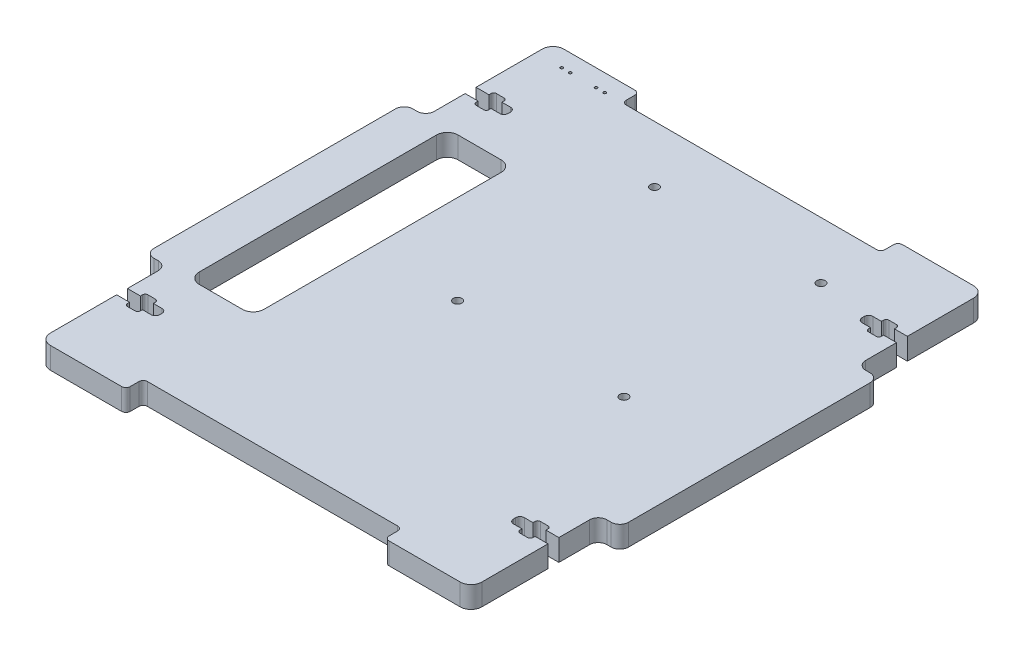
from build123d import *

# Parameters (mm, degrees)
SKETCH1_R           = 0.4
BOSS_EXTRUDE1_DEPTH = 6.35
SKETCH5_R           = 1.25
CUT_EXTRUDE3_DEPTH  = 6.35
SKETCH4_W           = 3.2
SKETCH4_H           = 6.35
CUT_EXTRUDE4_DEPTH  = 11.43
SKETCH2_W           = 3.2
SKETCH2_H           = 6.35
CUT_EXTRUDE5_DEPTH  = 11.43
FILLET1_R           = 1.27
SKETCH6_W           = 3.81
SKETCH6_H           = 6
CUT_EXTRUDE6_DEPTH  = 6.35
FILLET2_R           = 0.762


with BuildPart() as part:
    # Sketch1 → Boss-Extrude1 (new body)
    with BuildSketch(Plane(origin=(0, 0, 0), x_dir=(1, 0, 0), z_dir=(0, 1, 0))):
        with BuildLine():
            Line((-60.325, -75.565), (-39.37, -75.565))
            ThreePointArc((-39.37, -75.565), (-38.471974388, -75.193025612), (-38.1, -74.295))
            Line((-38.1, -74.295), (-38.1, -71.755))
            ThreePointArc((-38.1, -71.755), (-37.728025612, -70.856974388), (-36.83, -70.485))
            Line((-36.83, -70.485), (36.83, -70.485))
            ThreePointArc((36.83, -70.485), (37.728025612, -70.856974388), (38.1, -71.755))
            Line((38.1, -71.755), (38.1, -74.295))
            ThreePointArc((38.1, -74.295), (38.471974388, -75.193025612), (39.37, -75.565))
            Line((39.37, -75.565), (60.325, -75.565))
            ThreePointArc((60.325, -75.565), (62.57006403, -74.63506403), (63.5, -72.39))
            Line((63.5, -72.39), (63.5, -40.64))
            ThreePointArc((63.5, -40.64), (64.243948776, -38.843948776), (66.04, -38.1))
            Line((66.04, -38.1), (67.31, -38.1))
            ThreePointArc((67.31, -38.1), (69.106051224, -37.356051224), (69.85, -35.56))
            Line((69.85, -35.56), (69.85, 35.56))
            ThreePointArc((69.85, 35.56), (69.106051224, 37.356051224), (67.31, 38.1))
            Line((67.31, 38.1), (66.04, 38.1))
            ThreePointArc((66.04, 38.1), (64.243948776, 38.843948776), (63.5, 40.64))
            Line((63.5, 40.64), (63.5, 72.39))
            ThreePointArc((63.5, 72.39), (62.57006403, 74.63506403), (60.325, 75.565))
            Line((60.325, 75.565), (39.37, 75.565))
            ThreePointArc((39.37, 75.565), (38.471974388, 75.193025612), (38.1, 74.295))
            Line((38.1, 74.295), (38.1, 71.755))
            ThreePointArc((38.1, 71.755), (37.728025612, 70.856974388), (36.83, 70.485))
            Line((36.83, 70.485), (-36.83, 70.485))
            ThreePointArc((-36.83, 70.485), (-37.728025612, 70.856974388), (-38.1, 71.755))
            Line((-38.1, 71.755), (-38.1, 74.295))
            ThreePointArc((-38.1, 74.295), (-38.471974388, 75.193025612), (-39.37, 75.565))
            Line((-39.37, 75.565), (-60.325, 75.565))
            ThreePointArc((-60.325, 75.565), (-62.57006403, 74.63506403), (-63.5, 72.39))
            Line((-63.5, 72.39), (-63.5, 40.64))
            ThreePointArc((-63.5, 40.64), (-64.243948776, 38.843948776), (-66.04, 38.1))
            Line((-66.04, 38.1), (-67.31, 38.1))
            ThreePointArc((-67.31, 38.1), (-69.106051224, 37.356051224), (-69.85, 35.56))
            Line((-69.85, 35.56), (-69.85, -35.56))
            ThreePointArc((-69.85, -35.56), (-69.106051224, -37.356051224), (-67.31, -38.1))
            Line((-67.31, -38.1), (-66.04, -38.1))
            ThreePointArc((-66.04, -38.1), (-64.243948776, -38.843948776), (-63.5, -40.64))
            Line((-63.5, -40.64), (-63.5, -72.39))
            ThreePointArc((-63.5, -72.39), (-62.57006403, -74.63506403), (-60.325, -75.565))
        make_face()
        with Locations(Location((-45.72, 70.485, 0), (0, 0, 270))):
            Circle(SKETCH1_R, mode=Mode.SUBTRACT)
        with Locations(Location((-43.18, 70.485, 0), (0, 0, 270))):
            Circle(SKETCH1_R, mode=Mode.SUBTRACT)
        with Locations(Location((-55.88, 70.485, 0), (0, 0, 270))):
            Circle(SKETCH1_R, mode=Mode.SUBTRACT)
        with Locations(Location((-53.34, 70.485, 0), (0, 0, 270))):
            Circle(SKETCH1_R, mode=Mode.SUBTRACT)
        with BuildLine():
            Line((-53.975, -38.1), (-41.275, -38.1))
            ThreePointArc((-41.275, -38.1), (-39.02993597, -37.17006403), (-38.1, -34.925))
            Line((-38.1, -34.925), (-38.1, 34.925))
            ThreePointArc((-38.1, 34.925), (-39.02993597, 37.17006403), (-41.275, 38.1))
            Line((-41.275, 38.1), (-53.975, 38.1))
            ThreePointArc((-53.975, 38.1), (-56.22006403, 37.17006403), (-57.15, 34.925))
            Line((-57.15, 34.925), (-57.15, -34.925))
            ThreePointArc((-57.15, -34.925), (-56.22006403, -37.17006403), (-53.975, -38.1))
        make_face(mode=Mode.SUBTRACT)
    extrude(amount=-BOSS_EXTRUDE1_DEPTH)

    # Sketch5 → Cut-Extrude3 (cut)
    with BuildSketch(Plane(origin=(0, 0, 0), x_dir=(1, 0, 0), z_dir=(0, 1, 0))):
        with Locations(Location((-11.8, -4.235, 0), (0, 0, 270))):
            Circle(SKETCH5_R)
        with Locations(Location((-11.8, 53.765, 0), (0, 0, 270))):
            Circle(SKETCH5_R)
        with Locations(Location((37.2, -4.235, 0), (0, 0, 270))):
            Circle(SKETCH5_R)
        with Locations(Location((37.2, 53.765, 0), (0, 0, 270))):
            Circle(SKETCH5_R)
    extrude(amount=-CUT_EXTRUDE3_DEPTH, mode=Mode.SUBTRACT)

    # Sketch4 → Cut-Extrude4 (cut)
    with BuildSketch(Plane.ZY.offset(63.5)):
        with Locations((51.308, -3.175)):
            Rectangle(SKETCH4_W, SKETCH4_H)
        with Locations((-51.308, -3.175)):
            Rectangle(SKETCH4_W, SKETCH4_H)
    extrude(amount=-CUT_EXTRUDE4_DEPTH, mode=Mode.SUBTRACT)

    # Sketch2 → Cut-Extrude5 (cut)
    with BuildSketch(Plane(origin=(63.5, 0, 0), x_dir=(0, 0, -1), z_dir=(1, 0, 0))):
        with Locations((51.308, -3.175)):
            Rectangle(SKETCH2_W, SKETCH2_H)
        with Locations((-51.308, -3.175)):
            Rectangle(SKETCH2_W, SKETCH2_H)
    extrude(amount=-CUT_EXTRUDE5_DEPTH, mode=Mode.SUBTRACT)

    # Fillet1
    fillet1_edges = [part.edges().sort_by_distance(p)[0] for p in [
        (-52.07, -3.175, 49.708),
        (-52.07, -3.175, 52.908),
        (-52.07, -3.175, -52.908),
        (-52.07, -3.175, -49.708),
        (52.07, -3.175, -49.708),
        (52.07, -3.175, -52.908),
        (52.07, -3.175, 52.908),
        (52.07, -3.175, 49.708),
    ]]
    fillet(fillet1_edges, radius=FILLET1_R)

    # Sketch6 → Cut-Extrude6 (cut)
    with BuildSketch(Plane(origin=(0, 0, 0), x_dir=(1, 0, 0), z_dir=(0, 1, 0))):
        with Locations((57.785, -51.308)):
            Rectangle(SKETCH6_W, SKETCH6_H)
        with Locations((-57.785, -51.308)):
            Rectangle(SKETCH6_W, SKETCH6_H)
        with Locations((-57.785, 51.308)):
            Rectangle(SKETCH6_W, SKETCH6_H)
        with Locations((57.785, 51.308)):
            Rectangle(SKETCH6_W, SKETCH6_H)
    extrude(amount=-CUT_EXTRUDE6_DEPTH, mode=Mode.SUBTRACT)

    # Fillet2
    fillet2_edges = [part.edges().sort_by_distance(p)[0] for p in [
        (55.88, -3.175, -48.308),
        (59.69, -3.175, -54.308),
        (59.69, -3.175, -48.308),
        (55.88, -3.175, -54.308),
        (-55.88, -3.175, -54.308),
        (-59.69, -3.175, -48.308),
        (-59.69, -3.175, -54.308),
        (-55.88, -3.175, -48.308),
        (-55.88, -3.175, 48.308),
        (-59.69, -3.175, 48.308),
        (-55.88, -3.175, 54.308),
        (-59.69, -3.175, 54.308),
        (55.88, -3.175, 54.308),
        (59.69, -3.175, 48.308),
        (55.88, -3.175, 48.308),
        (59.69, -3.175, 54.308),
    ]]
    fillet(fillet2_edges, radius=FILLET2_R)


solid = part.part
